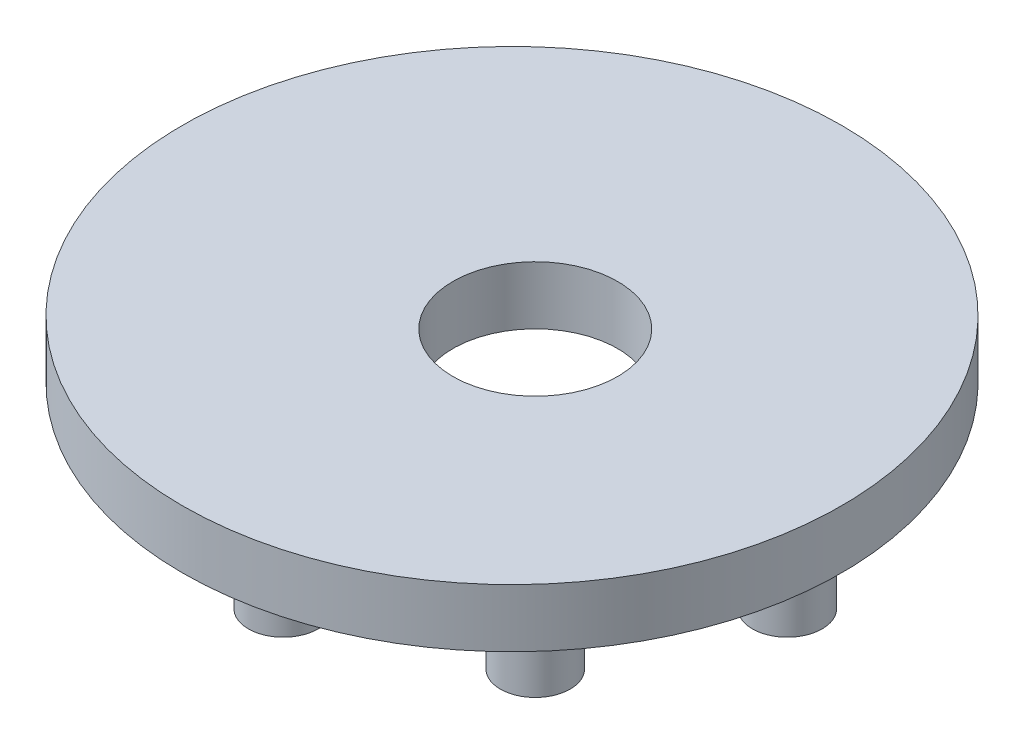
from build123d import *

# Parameters (mm, degrees)
SKETCH1_R           = 17
SKETCH1_R_2         = 1.8
SKETCH1_R_3         = 4.25
BOSS_EXTRUDE2_DEPTH = 3
BOSS_EXTRUDE4_START = -6
SKETCH2_R           = 1.8
BOSS_EXTRUDE4_DEPTH = 6
CIRPATTERN1_COUNT   = 8


with BuildPart() as part:
    # Sketch1 → Boss-Extrude2 (new body)
    with BuildSketch(Plane(origin=(0, 0, 0), x_dir=(1, 0, 0), z_dir=(0, 1, 0))):
        with Locations(Location((0, 0, 0), (0, 0, 270))):
            Circle(SKETCH1_R)
        with Locations(Location((-7.992388155, 9.192388155, 0), (0, 0, 270))):
            Circle(SKETCH1_R_2, mode=Mode.SUBTRACT)
        with Locations(Location((1.2, 0, 0), (0, 0, 270))):
            Circle(SKETCH1_R_3, mode=Mode.SUBTRACT)
        with Locations(Location((1.2, 13, 0), (0, 0, 270))):
            Circle(SKETCH1_R_2, mode=Mode.SUBTRACT)
        with Locations(Location((10.392388155, 9.192388155, 0), (0, 0, 270))):
            Circle(SKETCH1_R_2, mode=Mode.SUBTRACT)
        with Locations(Location((14.2, 0, 0), (0, 0, 270))):
            Circle(SKETCH1_R_2, mode=Mode.SUBTRACT)
        with Locations(Location((10.392388155, -9.192388155, 0), (0, 0, 270))):
            Circle(SKETCH1_R_2, mode=Mode.SUBTRACT)
        with Locations(Location((1.2, -13, 0), (0, 0, 270))):
            Circle(SKETCH1_R_2, mode=Mode.SUBTRACT)
        with Locations(Location((-7.992388155, -9.192388155, 0), (0, 0, 270))):
            Circle(SKETCH1_R_2, mode=Mode.SUBTRACT)
        with Locations(Location((-11.8, 0, 0), (0, 0, 270))):
            Circle(SKETCH1_R_2, mode=Mode.SUBTRACT)
    extrude(amount=BOSS_EXTRUDE2_DEPTH)

    # Sketch2 → Boss-Extrude4 (add)
    with BuildSketch(Plane(origin=(0, 3, 0), x_dir=(1, 0, 0), z_dir=(0, 1, 0)).offset(BOSS_EXTRUDE4_START)):
        with Locations(Location((-7.992388155, 9.192388155, 0), (0, 0, 270))):
            Circle(SKETCH2_R)
    boss_extrude4 = extrude(amount=BOSS_EXTRUDE4_DEPTH)

    # CirPattern1: Boss-Extrude4 ×8 about axis
    cirpattern1_axis = Axis((1.2, 0, 0), (0, 1, 0))
    for i in range(1, CIRPATTERN1_COUNT):
        add(boss_extrude4.rotate(cirpattern1_axis, i * 360 / CIRPATTERN1_COUNT))


solid = part.part
